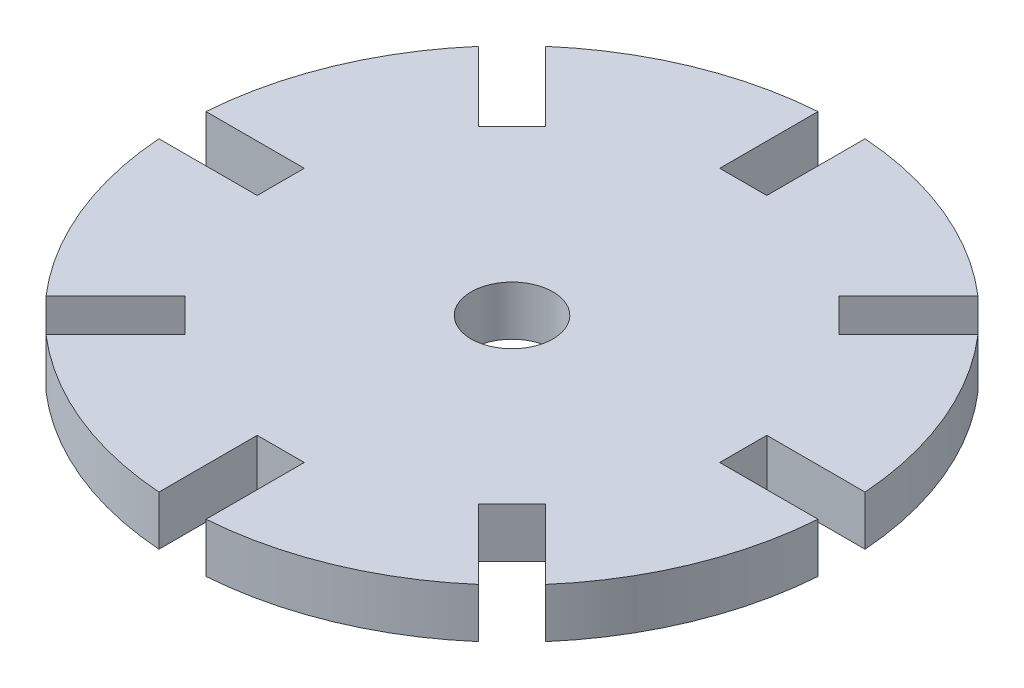
from build123d import *

# Parameters (mm, degrees)
BOSS_EXTRUDE1_DEPTH      = 1.5
BOSS_EXTRUDE1_DEPTH_BACK = 1.5
SKETCH1_R                = 20
SKETCH1_R_2              = 2.475
SKETCH2_W                = 12
SKETCH2_H                = 2.85
CUT_EXTRUDE1_DEPTH       = 29.442925307
CIRPATTERN1_COUNT        = 8


with BuildPart() as part:
    # Sketch1 → Boss-Extrude1 (new, two sides: drawn at the far end of the back side and taken through both)
    with BuildSketch(Plane(origin=(0, 0, 0), x_dir=(1, 0, 0), z_dir=(0, 1, 0)).offset(-BOSS_EXTRUDE1_DEPTH_BACK)):
        Circle(SKETCH1_R)
        Circle(SKETCH1_R_2, mode=Mode.SUBTRACT)
    extrude(amount=BOSS_EXTRUDE1_DEPTH + BOSS_EXTRUDE1_DEPTH_BACK)

    # Sketch2 → Cut-Extrude1 (cut, through all)
    with BuildSketch(Plane(origin=(0, 1.5, 0), x_dir=(1, 0, 0), z_dir=(0, 1, 0))):
        with Locations((20, 0)):
            Rectangle(SKETCH2_W, SKETCH2_H)
    cut_extrude1 = extrude(amount=-CUT_EXTRUDE1_DEPTH, mode=Mode.SUBTRACT)

    # CirPattern1: Cut-Extrude1 ×8 about axis
    cirpattern1_axis = Axis((0, 1.74625, 0), (0, -1, 0))
    for i in range(1, CIRPATTERN1_COUNT):
        add(cut_extrude1.rotate(cirpattern1_axis, i * 360 / CIRPATTERN1_COUNT), mode=Mode.SUBTRACT)


solid = part.part
